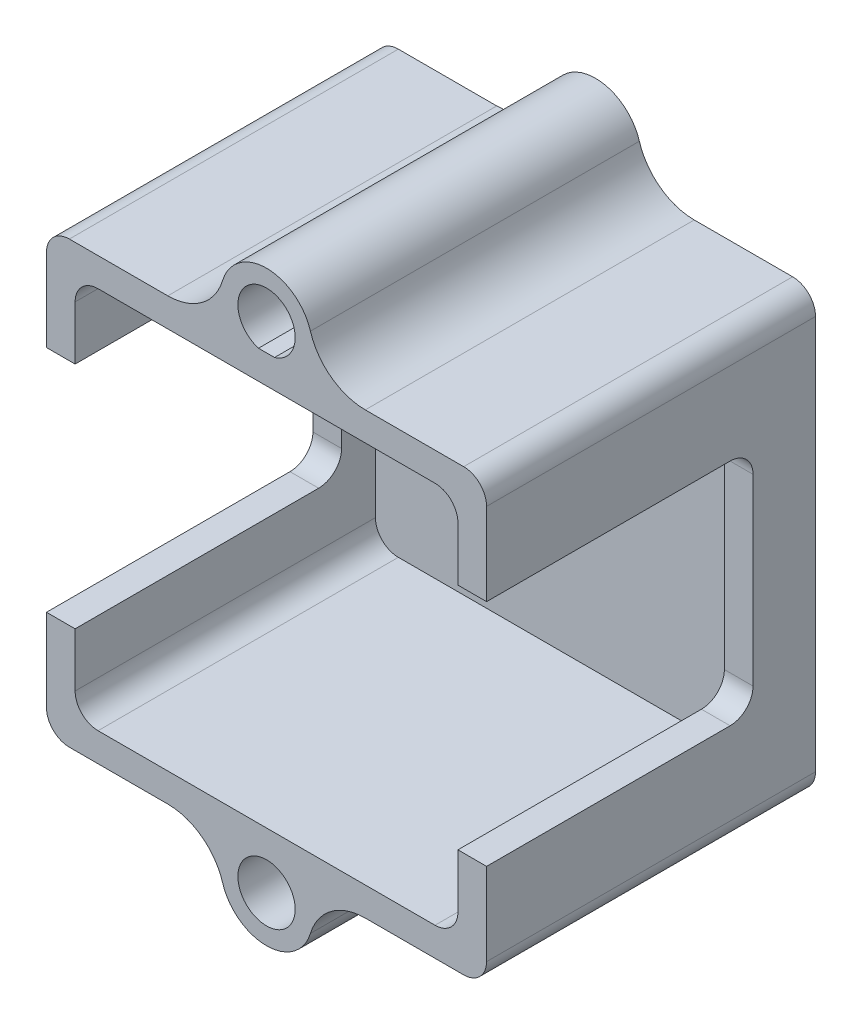
from build123d import *

# Parameters (mm, degrees)
SKETCH1_W           = 42.418
SKETCH1_H           = 42.418
SKETCH1_R           = 3.175
BOSS_EXTRUDE1_DEPTH = 36.449
BOSS_EXTRUDE2_REACH = 68.815
SKETCH2_W           = 3.175
SKETCH2_H           = 42.418
SKETCH4_W           = 29.523081252
SKETCH4_H           = 25.4
CUT_EXTRUDE2_DEPTH  = 70.020848799
FILLET1_R           = 2.54
FILLET2_R           = 6.35


with BuildPart() as part:
    # Sketch1 → Boss-Extrude1 (new body)
    with BuildSketch(Plane.XY):
        with BuildLine():
            Line((4.064, -24.384), (24.384, -24.384))
            Line((24.384, -24.384), (24.384, 24.384))
            Line((24.384, 24.384), (4.064, 24.384))
            ThreePointArc((4.064, 24.384), (0, 32.512), (-4.064, 24.384))
            Line((-4.064, 24.384), (-24.384, 24.384))
            Line((-24.384, 24.384), (-24.384, -24.384))
            Line((-24.384, -24.384), (-4.064, -24.384))
            ThreePointArc((-4.064, -24.384), (0, -32.512), (4.064, -24.384))
        make_face()
        with BuildLine():
            ThreePointArc((-0.889, 24.384), (0, 30.607), (0.889, 24.384))
            Line((0.889, 24.384), (-0.889, 24.384))
        make_face(mode=Mode.SUBTRACT)
        Rectangle(SKETCH1_W, SKETCH1_H, mode=Mode.SUBTRACT)
        with Locations((0, -27.432)):
            Circle(SKETCH1_R, mode=Mode.SUBTRACT)
    extrude(amount=BOSS_EXTRUDE1_DEPTH)

    # Sketch2 → Boss-Extrude2 (add, up to next)
    with BuildSketch(Plane(origin=(-21.209, 0, 0), x_dir=(0, 0, -1), z_dir=(1, 0, 0)), mode=Mode.PRIVATE) as boss_extrude2_sk1:
        with Locations((-1.5875, 0)):
            Rectangle(SKETCH2_W, SKETCH2_H)
    boss_extrude2_tool1 = extrude(boss_extrude2_sk1.sketch, amount=BOSS_EXTRUDE2_REACH, mode=Mode.PRIVATE) - part.part
    add(boss_extrude2_tool1.solids().sort_by_distance((-21.209, 0, 1.5875))[0])

    # Sketch4 → Cut-Extrude2 (cut, through all)
    with BuildSketch(Plane(origin=(24.384, 0, 0), x_dir=(0, 0, -1), z_dir=(1, 0, 0))):
        with Locations((-21.687459374, 0)):
            Rectangle(SKETCH4_W, SKETCH4_H)
    extrude(amount=-CUT_EXTRUDE2_DEPTH, mode=Mode.SUBTRACT)

    # Fillet1
    fillet1_edges = [part.edges().sort_by_distance(p)[0] for p in [
        (-21.209, -21.209, 19.812),
        (21.209, -21.209, 19.812),
        (21.209, 21.209, 19.812),
        (-21.209, 21.209, 19.812),
        (24.384, 24.384, 18.2245),
        (24.384, -24.384, 18.2245),
        (-24.384, -24.384, 18.2245),
        (-24.384, 24.384, 18.2245),
        (22.7965, 12.7, 6.925918748),
        (22.7965, -12.7, 6.925918748),
        (-22.7965, 12.7, 6.925918748),
        (-22.7965, -12.7, 6.925918748),
    ]]
    fillet(fillet1_edges, radius=FILLET1_R)

    # Fillet2
    fillet2_edges = [part.edges().sort_by_distance(p)[0] for p in [
        (4.064, 24.384, 18.2245),
        (4.064, -24.384, 18.2245),
        (-4.064, -24.384, 18.2245),
        (-4.064, 24.384, 18.2245),
    ]]
    fillet(fillet2_edges, radius=FILLET2_R)


solid = part.part
